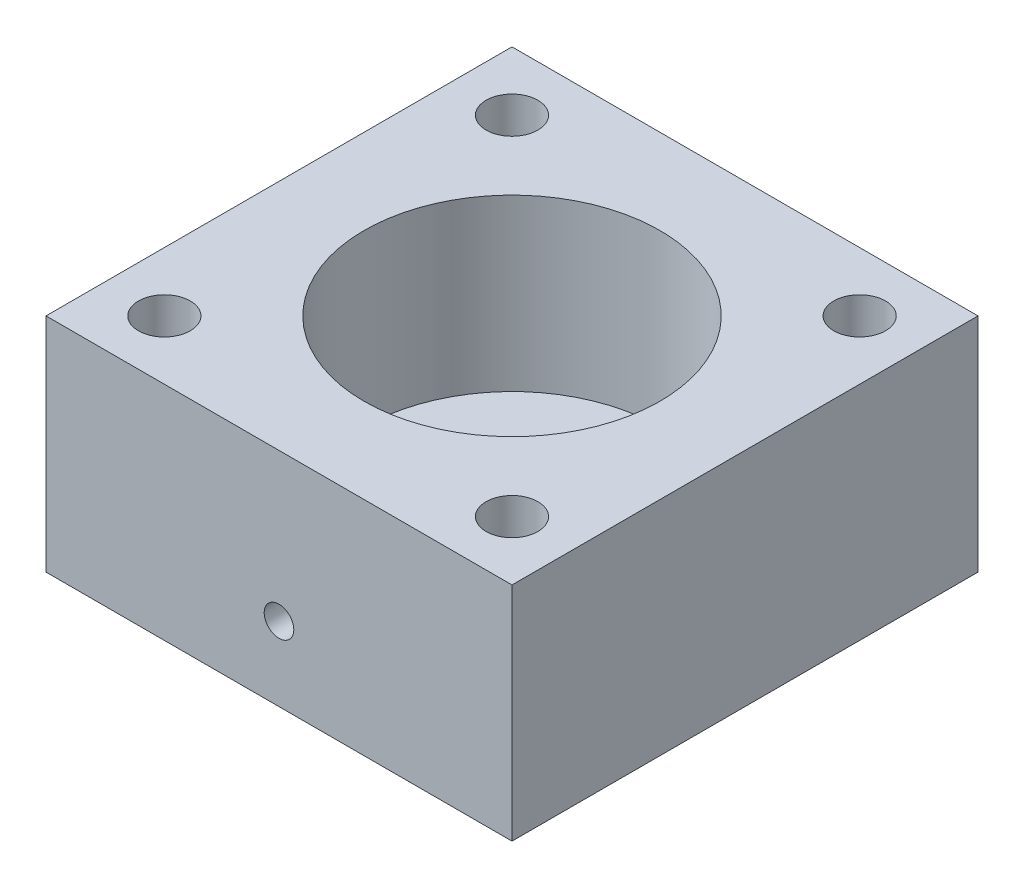
from build123d import *

# Parameters (mm, degrees)
CROQUIS1_W                 = 31.5
CROQUIS1_H                 = 31.5
SALIENTE_EXTRUIR1_DEPTH    = 15
CROQUIS3_R                 = 10
CORTAR_EXTRUIR1_DEPTH      = 11.5
CROQUIS6_R                 = 1.75
CORTAR_EXTRUIR2_DEPTH      = 27.853770685
CORTAR_EXTRUIR3_REACH      = 40.279
CORTAR_EXTRUIR3_END_RADIUS = 10
CROQUIS7_R                 = 1


with BuildPart() as part:
    # Croquis1 → Saliente-Extruir1 (new body)
    with BuildSketch(Plane(origin=(0, 0, 0), x_dir=(1, 0, 0), z_dir=(0, 1, 0))):
        Rectangle(CROQUIS1_W, CROQUIS1_H)
    extrude(amount=SALIENTE_EXTRUIR1_DEPTH)

    # Croquis3 → Cortar-Extruir1 (cut)
    with BuildSketch(Plane(origin=(0, 15, 0), x_dir=(1, 0, 0), z_dir=(0, 1, 0))):
        with Locations(Location((0, 0, 0), (0, 0, 270))):
            Circle(CROQUIS3_R)
    extrude(amount=-CORTAR_EXTRUIR1_DEPTH, mode=Mode.SUBTRACT)

    # Croquis6 → Cortar-Extruir2 (cut, through all)
    with BuildSketch(Plane(origin=(0, 15, 0), x_dir=(1, 0, 0), z_dir=(0, 1, 0))):
        with Locations(Location((-11.75, -11.75, 0), (0, 0, 270))):
            Circle(CROQUIS6_R)
        with Locations(Location((11.75, -11.75, 0), (0, 0, 90))):
            Circle(CROQUIS6_R)
        with Locations(Location((11.75, 11.75, 0), (0, 0, 270))):
            Circle(CROQUIS6_R)
        with Locations(Location((-11.75, 11.75, 0), (0, 0, 90))):
            Circle(CROQUIS6_R)
    extrude(amount=-CORTAR_EXTRUIR2_DEPTH, mode=Mode.SUBTRACT)

    # Cortar-Extruir3: up to this cylinder (the profile starts outside it)
    cortar_extruir3_end = Plane(origin=(0, 5, 0), z_dir=(0, 1, 0)) * Cylinder(CORTAR_EXTRUIR3_END_RADIUS, 101.558, mode=Mode.PRIVATE)
    # Croquis7 → Cortar-Extruir3 (cut, up to the surface)
    with BuildSketch(Plane.XY.offset(15.75), mode=Mode.PRIVATE) as cortar_extruir3_sk1:
        with Locations((0, 5)):
            Circle(CROQUIS7_R)
    cortar_extruir3_tool1 = extrude(cortar_extruir3_sk1.sketch, amount=-CORTAR_EXTRUIR3_REACH, mode=Mode.PRIVATE) - cortar_extruir3_end
    add(cortar_extruir3_tool1.solids().sort_by_distance((0, 5, 15.75))[0], mode=Mode.SUBTRACT)


solid = part.part
